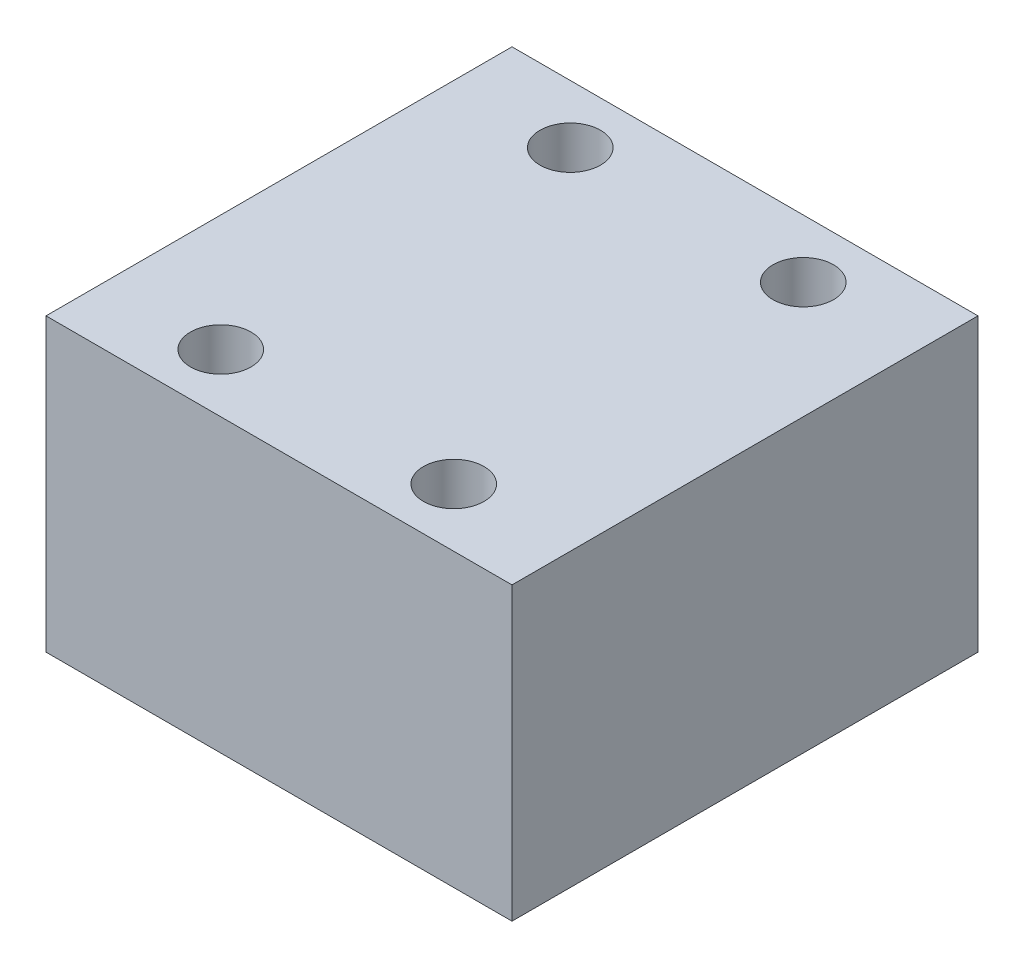
from build123d import *

# Parameters (mm, degrees)
EXTRUDE_1_DEPTH      = 12.5
EXTRUDE_1_DEPTH_BACK = 12.5
SKETCH_1_W           = 40
SKETCH_1_H           = 40
SKETCH_2_R           = 2.6
CUT_EXTRUDE_3_DEPTH  = 38.749172176


with BuildPart() as part:
    # 草图1 → 凸台-拉伸1 (new, two sides: drawn at the far end of the back side and taken through both)
    with BuildSketch(Plane(origin=(0, 0, 0), x_dir=(1, 0, 0), z_dir=(0, 1, 0)).offset(-EXTRUDE_1_DEPTH_BACK)):
        Rectangle(SKETCH_1_W, SKETCH_1_H)
    extrude(amount=EXTRUDE_1_DEPTH + EXTRUDE_1_DEPTH_BACK)

    # 草图2 → 切除-拉伸3 (cut, through all)
    with BuildSketch(Plane(origin=(0, 12.5, 0), x_dir=(1, 0, 0), z_dir=(0, 1, 0))):
        with Locations((-10, 15)):
            Circle(SKETCH_2_R)
        with Locations((10, 15)):
            Circle(SKETCH_2_R)
        with Locations((-10, -15)):
            Circle(SKETCH_2_R)
        with Locations((10, -15)):
            Circle(SKETCH_2_R)
    extrude(amount=-CUT_EXTRUDE_3_DEPTH, mode=Mode.SUBTRACT)


solid = part.part
